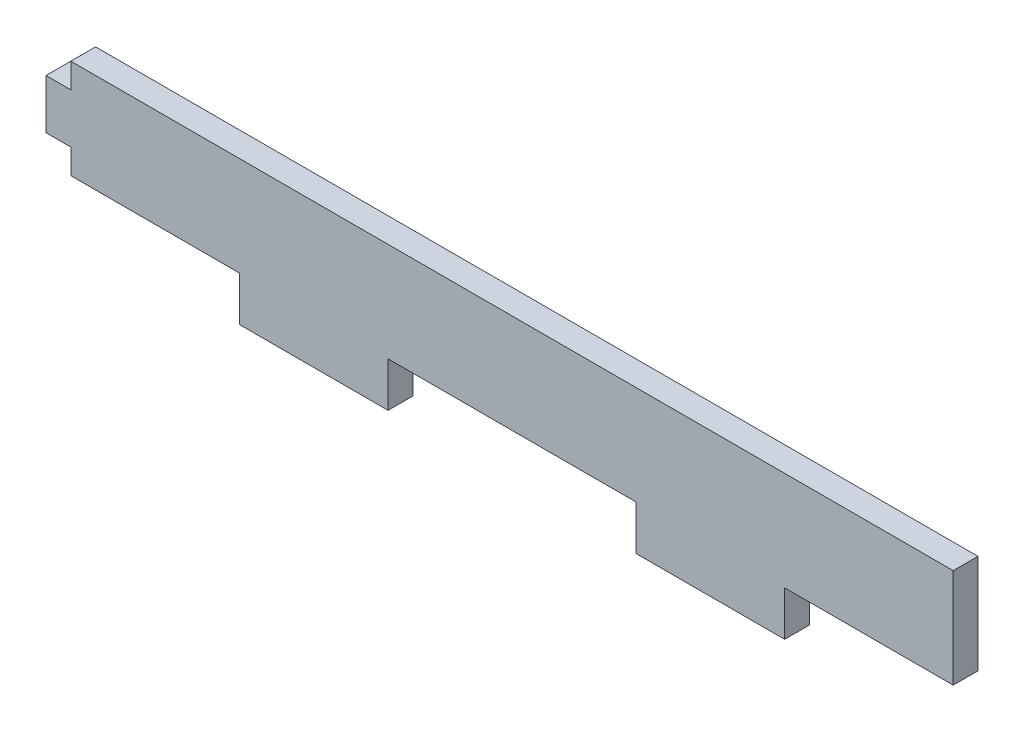
from build123d import *

# Parameters (mm, degrees)
BOSS_EXTRUDE1_DEPTH = 5


with BuildPart() as part:
    # Sketch1 → Boss-Extrude1 (new body)
    with BuildSketch(Plane.XY):
        Polygon((5, 5.5), (5, 10.5), (0, 10.5), (0, 20.5), (5, 20.5), (5, 25.5), (183, 25.5), (183, 5.5), (149, 5.5), (149, -3.5), (119, -3.5), (119, 5.5), (69, 5.5), (69, -3.5), (39, -3.5), (39, 5.5), align=None)
    extrude(amount=BOSS_EXTRUDE1_DEPTH)


solid = part.part
